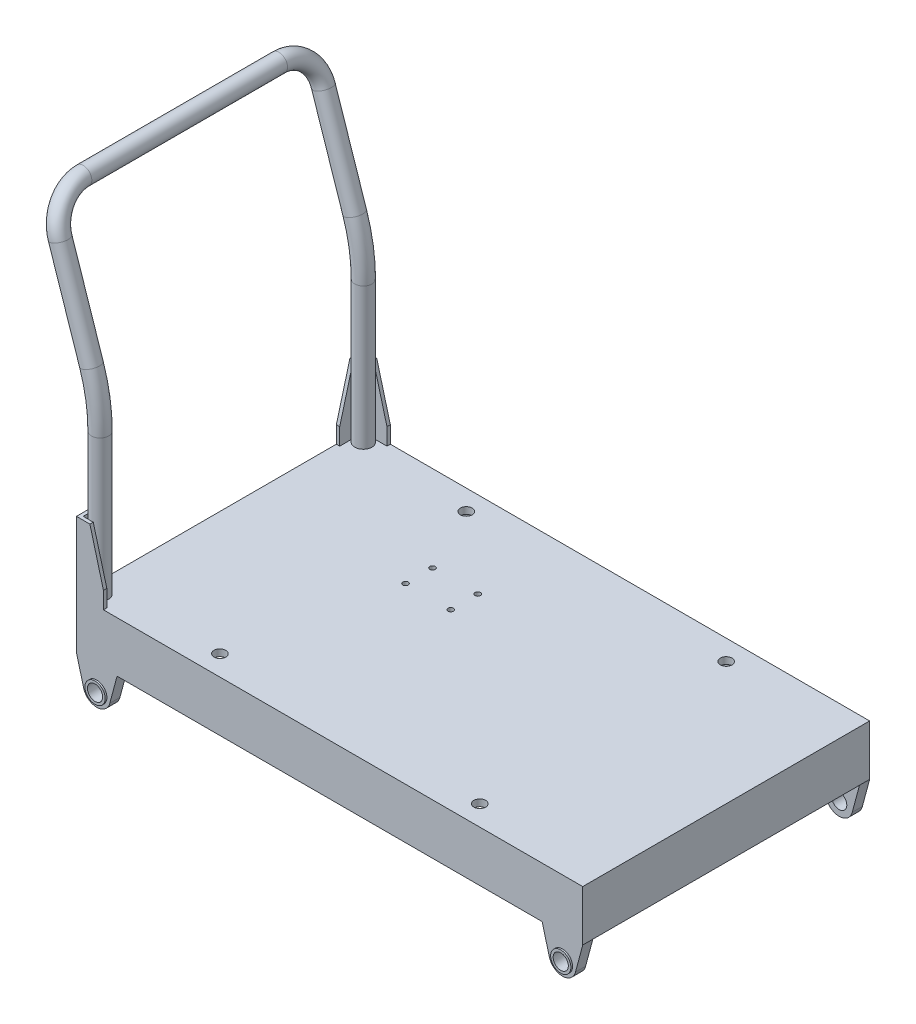
from build123d import *
from OCP.BRepFilletAPI import BRepFilletAPI_MakeChamfer

# Parameters (mm, degrees)
SKETCH_1_W                  = 150
SKETCH_1_H                  = 85
EXTRUDE_1_DEPTH             = 2
SKETCH_1_2_W                = 150
SKETCH_1_2_H                = 85
SKETCH_1_2_W_2              = 144
SKETCH_1_2_H_2              = 79
EXTRUDE_1_2_DEPTH           = 15
SKETCH_4_R                  = 2.25
EXTRUDE_2_DEPTH             = 3
CUT_EXTRUDE_2_REACH         = 92.04
SKETCH_6_R                  = 1.75
SKETCH_10_W                 = 1
SKETCH_10_H                 = 1
SKETCH_10_W_2               = 7
SKETCH_10_H_2               = 7
EXTRUDE_4_DEPTH             = 20
CHAMFER_1_SIZE              = 15
CHAMFER_1_SIZE2             = 4.019237886
SKETCH_13_R                 = 3
SKETCH_13_R_2               = 2.25
EXTRUDE_5_DEPTH             = 0.5
CHAMFER_1_OF_MIRROR_2_SIZE  = 15
CHAMFER_1_OF_MIRROR_2_SIZE2 = 4.019237886
SKETCH_12_R                 = 2.55
HOLE_WIZARD_M2_1_D          = 1.6


with BuildPart() as part:
    # 草圖1 → Extrude 1 (new body)
    with BuildSketch(Plane(origin=(0, 0, 0), x_dir=(1, 0, 0), z_dir=(0, 1, 0))):
        Rectangle(SKETCH_1_W, SKETCH_1_H)
    extrude(amount=-EXTRUDE_1_DEPTH)

    # 草圖1<2> → Extrude 1 2 (add)
    with BuildSketch(Plane(origin=(0, 0, 0), x_dir=(1, 0, 0), z_dir=(0, 1, 0))):
        Rectangle(SKETCH_1_2_W, SKETCH_1_2_H)
        Rectangle(SKETCH_1_2_W_2, SKETCH_1_2_H_2, mode=Mode.SUBTRACT)
    extrude(amount=-EXTRUDE_1_2_DEPTH)

    # 草圖4 → 填料-伸長2 (add)
    # profile 1 of 2: a face of its own
    with BuildSketch(Plane.XY.offset(42.5)):
        with BuildLine():
            Line((-75, -15), (-72.846954236, -23.03527618))
            ThreePointArc((-72.846954236, -23.03527618), (-68.983250931, -26), (-65.119547626, -23.03527618))
            Line((-65.119547626, -23.03527618), (-62.966501863, -15))
            Line((-62.966501863, -15), (-75, -15))
        make_face()
        with Locations(Location((-68.983250931, -22, 0), (0, 0, 180))):
            Circle(SKETCH_4_R, mode=Mode.SUBTRACT)
    # profile 2 of 2: a face of its own
    with BuildSketch(Plane.XY.offset(42.5)):
        with BuildLine():
            Line((62.966501863, -15), (75, -15))
            Line((75, -15), (72.846954236, -23.03527618))
            ThreePointArc((72.846954236, -23.03527618), (68.983250931, -26), (65.119547626, -23.03527618))
            Line((65.119547626, -23.03527618), (62.966501863, -15))
        make_face()
        with Locations((68.983250931, -22)):
            Circle(SKETCH_4_R, mode=Mode.SUBTRACT)
    extrude_2 = extrude(amount=-EXTRUDE_2_DEPTH)

    # 鏡射1: 填料-伸長2 across plane
    add(extrude_2.mirror(Plane.XY))

    # 草圖6 → 除料-伸長2 (cut, up to next)
    with BuildSketch(Plane(origin=(0, 0, 0), x_dir=(1, 0, 0), z_dir=(0, 1, 0)), mode=Mode.PRIVATE) as cut_extrude_2_sk1:
        with Locations(Location((-38.5, -36.5, 0), (0, 0, 270))):
            Circle(SKETCH_6_R)
    cut_extrude_2_tool1 = extrude(cut_extrude_2_sk1.sketch, amount=-CUT_EXTRUDE_2_REACH, mode=Mode.PRIVATE) & part.part
    # 草圖6 → 除料-伸長2 (cut, up to next)
    with BuildSketch(Plane(origin=(0, 0, 0), x_dir=(1, 0, 0), z_dir=(0, 1, 0)), mode=Mode.PRIVATE) as cut_extrude_2_sk2:
        with Locations(Location((38.5, -36.5, 0), (0, 0, 270))):
            Circle(SKETCH_6_R)
    cut_extrude_2_tool2 = extrude(cut_extrude_2_sk2.sketch, amount=-CUT_EXTRUDE_2_REACH, mode=Mode.PRIVATE) & part.part
    # 草圖6 → 除料-伸長2 (cut, up to next)
    with BuildSketch(Plane(origin=(0, 0, 0), x_dir=(1, 0, 0), z_dir=(0, 1, 0)), mode=Mode.PRIVATE) as cut_extrude_2_sk3:
        with Locations(Location((38.5, 36.5, 0), (0, 0, 270))):
            Circle(SKETCH_6_R)
    cut_extrude_2_tool3 = extrude(cut_extrude_2_sk3.sketch, amount=-CUT_EXTRUDE_2_REACH, mode=Mode.PRIVATE) & part.part
    # 草圖6 → 除料-伸長2 (cut, up to next)
    with BuildSketch(Plane(origin=(0, 0, 0), x_dir=(1, 0, 0), z_dir=(0, 1, 0)), mode=Mode.PRIVATE) as cut_extrude_2_sk4:
        with Locations(Location((-38.5, 36.5, 0), (0, 0, 270))):
            Circle(SKETCH_6_R)
    cut_extrude_2_tool4 = extrude(cut_extrude_2_sk4.sketch, amount=-CUT_EXTRUDE_2_REACH, mode=Mode.PRIVATE) & part.part
    add(cut_extrude_2_tool1.solids().sort_by_distance((-38.5, 0, 36.5))[0], mode=Mode.SUBTRACT)
    add(cut_extrude_2_tool2.solids().sort_by_distance((38.5, 0, 36.5))[0], mode=Mode.SUBTRACT)
    add(cut_extrude_2_tool3.solids().sort_by_distance((38.5, 0, -36.5))[0], mode=Mode.SUBTRACT)
    add(cut_extrude_2_tool4.solids().sort_by_distance((-38.5, 0, -36.5))[0], mode=Mode.SUBTRACT)

    # 草圖10 → 填料-伸長4 (add)
    with BuildSketch(Plane(origin=(0, 0, 0), x_dir=(1, 0, 0), z_dir=(0, 1, 0))):
        with Locations((-74.5, -42)):
            Rectangle(SKETCH_10_W, SKETCH_10_H)
        with Locations((-70.5, -42)):
            Rectangle(SKETCH_10_W_2, SKETCH_10_H)
        with Locations((-74.5, -38)):
            Rectangle(SKETCH_10_W, SKETCH_10_H_2)
    extrude_4 = extrude(amount=EXTRUDE_4_DEPTH)

    # 導角1: one chamfer whose edges measure the first distance from different faces: ONE call of the kernel's chamfer builder (chamfer() names one face for all edges)
    chamfer_1_edges_1 = [part.edges().sort_by_distance(p)[0] for p in [
        (-67, 20, 42),
    ]]
    chamfer_1_side_1 = [part.faces().sort_by_distance(p)[0] for p in [
        (-67, 10, 42),
    ]]
    chamfer_1_edges_2 = [part.edges().sort_by_distance(p)[0] for p in [
        (-74.5, 20, 34.5),
    ]]
    chamfer_1_side_2 = [part.faces().sort_by_distance(p)[0] for p in [
        (-74.5, 10, 34.5),
    ]]
    chamfer_1 = BRepFilletAPI_MakeChamfer(part.part.solid().wrapped)
    for e in chamfer_1_edges_1:
        chamfer_1.Add(CHAMFER_1_SIZE, CHAMFER_1_SIZE2, e.wrapped, chamfer_1_side_1[0].wrapped)  # the first distance lies on this face
    for e in chamfer_1_edges_2:
        chamfer_1.Add(CHAMFER_1_SIZE, CHAMFER_1_SIZE2, e.wrapped, chamfer_1_side_2[0].wrapped)  # the first distance lies on this face
    add(Compound.cast(chamfer_1.Shape()), mode=Mode.REPLACE)

    # 草圖13 → 填料-伸長5 (add)
    # profile 1 of 2: a face of its own
    with BuildSketch(Plane.XY.offset(42.5)):
        with Locations((68.983250931, -22)):
            Circle(SKETCH_13_R)
        with Locations((68.983250931, -22)):
            Circle(SKETCH_13_R_2, mode=Mode.SUBTRACT)
    # profile 2 of 2: a face of its own
    with BuildSketch(Plane.XY.offset(42.5)):
        with Locations(Location((-68.983250931, -22, 0), (0, 0, 180))):
            Circle(SKETCH_13_R)
        with Locations(Location((-68.983250931, -22, 0), (0, 0, 180))):
            Circle(SKETCH_13_R_2, mode=Mode.SUBTRACT)
    extrude_5 = extrude(amount=EXTRUDE_5_DEPTH)

    # 鏡射2: 填料-伸長4, 填料-伸長5 across plane
    add(extrude_4.mirror(Plane.XY))
    add(extrude_5.mirror(Plane.XY))

    # 導角1 of 鏡射2: one chamfer whose edges measure the first distance from different faces: ONE call of the kernel's chamfer builder (chamfer() names one face for all edges)
    chamfer_1_of_mirror_2_edges_1 = [part.edges().sort_by_distance(p)[0] for p in [
        (-67, 20, -42),
    ]]
    chamfer_1_of_mirror_2_side_1 = [part.faces().sort_by_distance(p)[0] for p in [
        (-67, 10, -42),
    ]]
    chamfer_1_of_mirror_2_edges_2 = [part.edges().sort_by_distance(p)[0] for p in [
        (-74.5, 20, -34.5),
    ]]
    chamfer_1_of_mirror_2_side_2 = [part.faces().sort_by_distance(p)[0] for p in [
        (-74.5, 10, -34.5),
    ]]
    chamfer_1_of_mirror_2 = BRepFilletAPI_MakeChamfer(part.part.solid().wrapped)
    for e in chamfer_1_of_mirror_2_edges_1:
        chamfer_1_of_mirror_2.Add(CHAMFER_1_OF_MIRROR_2_SIZE, CHAMFER_1_OF_MIRROR_2_SIZE2, e.wrapped, chamfer_1_of_mirror_2_side_1[0].wrapped)  # the first distance lies on this face
    for e in chamfer_1_of_mirror_2_edges_2:
        chamfer_1_of_mirror_2.Add(CHAMFER_1_OF_MIRROR_2_SIZE, CHAMFER_1_OF_MIRROR_2_SIZE2, e.wrapped, chamfer_1_of_mirror_2_side_2[0].wrapped)  # the first distance lies on this face
    add(Compound.cast(chamfer_1_of_mirror_2.Shape()), mode=Mode.REPLACE)

    # 掃出17: sweep along a curve in space
    with BuildLine() as sweep_17_path:
        Line((-71.5, 0, 39), (-71.5, 41.886116992, 39))
        ThreePointArc((-71.5, 41.886116992, 39), (-72.145627118, 49.895229142, 39), (-74.065835097, 57.697505292, 39))
        Line((-83.33772234, 85.513167019, 39), (-74.065835097, 57.697505292, 39))
        ThreePointArc((-86.5, 95, 29), (-85.573790317, 92.221370952, 36.071067812), (-83.33772234, 85.513167019, 39))
        Line((-86.5, 95, 29), (-86.5, 95, -29))
        ThreePointArc((-86.5, 95, -29), (-85.573790317, 92.221370952, -36.071067812), (-83.33772234, 85.513167019, -39))
        Line((-83.33772234, 85.513167019, -39), (-74.065835097, 57.697505292, -39))
        ThreePointArc((-71.5, 41.886116992, -39), (-72.145627118, 49.895229142, -39), (-74.065835097, 57.697505292, -39))
        Line((-71.5, 41.886116992, -39), (-71.5, 0, -39))
    # 草圖12 → 掃出17 (sweep)
    with BuildSketch(Plane(origin=(0, 0, 0), x_dir=(1, 0, 0), z_dir=(0, 1, 0))):
        with Locations((-71.5, 39)):
            Circle(SKETCH_12_R)
    sweep(path=sweep_17_path.line)

    # M2 螺紋孔1 (through all)
    with Locations(Plane(origin=(0, 0, 0), x_dir=(1, 0, 0), z_dir=(0, 1, 0))):
        with Locations((-29, 17), (-15.6, 17), (-15.6, 9), (-29, 9)):
            Hole(HOLE_WIZARD_M2_1_D / 2)


solid = part.part
